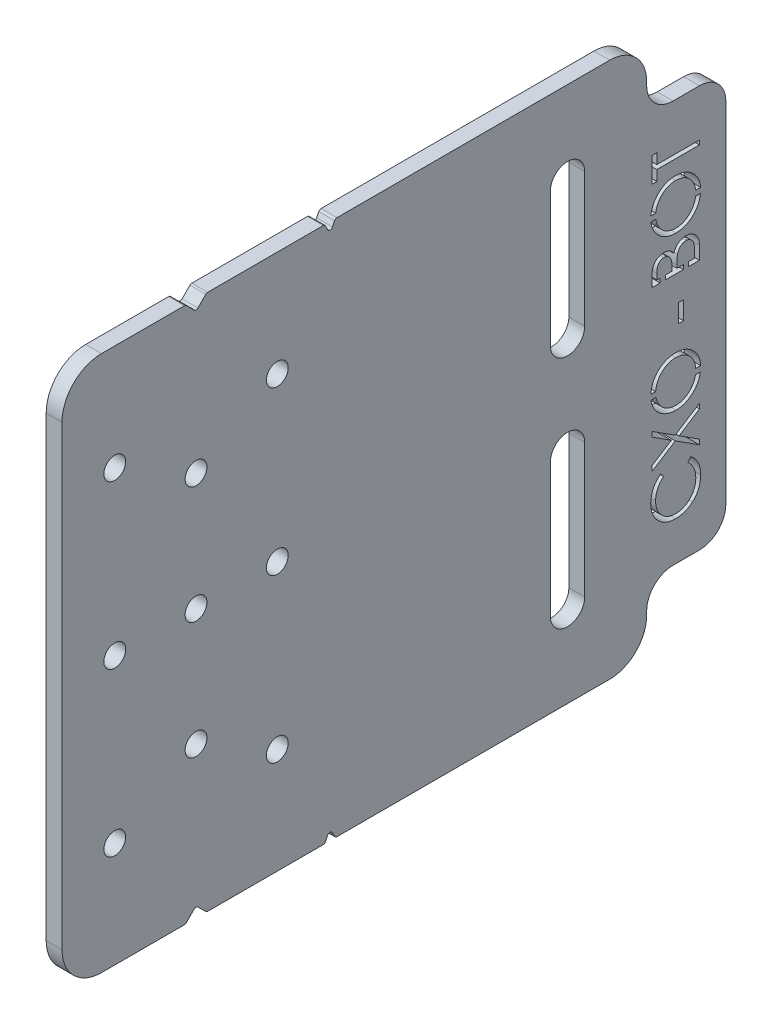
from build123d import *

# Parameters (mm, degrees)
SKETCH1_R           = 2.07
BOSS_EXTRUDE1_DEPTH = 1.5
FILLET1_R           = 7.5
FILLET2_R           = 0.5
FILLET3_R           = 7
SKETCH2_W           = 15
SKETCH2_H           = 76.2
BOSS_EXTRUDE2_DEPTH = 3
FILLET5_R           = 5
SKETCH3_W           = 0.923076923
SKETCH3_H           = 3.461538462
CUT_EXTRUDE2_DEPTH  = 10
SKETCH5_W           = 14.375522983
SKETCH5_H           = 1
SKETCH5_W_2         = 13.468681042
EXTRUDE_THIN2_DEPTH = 3


with BuildPart() as part:
    # Sketch1 → Boss-Extrude1 (new, symmetric)
    with BuildSketch(Plane(origin=(0, 0, 0), x_dir=(0, 0, -1), z_dir=(1, 0, 0))):
        Polygon((-2, 50.8), (-25.4, 50.8), (-25.4, -50.8), (-2, -50.8), (0, -48.8), (2, -50.8), (24.4, -50.8), (25.4, -48.8), (26.4, -50.8), (85.4, -50.8), (85.4, 50.8), (26.4, 50.8), (25.4, 48.8), (24.4, 50.8), (2, 50.8), (0, 48.8), align=None)
        with Locations((-15.4, -30.8)):
            Circle(SKETCH1_R, mode=Mode.SUBTRACT)
        with Locations((15.4, -30.8)):
            Circle(SKETCH1_R, mode=Mode.SUBTRACT)
        with Locations((0, -22.225)):
            Circle(SKETCH1_R, mode=Mode.SUBTRACT)
        with Locations((-15.4, 0)):
            Circle(SKETCH1_R, mode=Mode.SUBTRACT)
        Circle(SKETCH1_R, mode=Mode.SUBTRACT)
        with Locations((0, 22.225)):
            Circle(SKETCH1_R, mode=Mode.SUBTRACT)
        with Locations((15.4, 0)):
            Circle(SKETCH1_R, mode=Mode.SUBTRACT)
        with Locations((-15.4, 30.8)):
            Circle(SKETCH1_R, mode=Mode.SUBTRACT)
        with Locations((15.4, 30.8)):
            Circle(SKETCH1_R, mode=Mode.SUBTRACT)
        with BuildLine():
            Line((73.65, 34.925), (73.65, 9.525))
            ThreePointArc((73.65, 9.525), (70.4, 6.275), (67.15, 9.525))
            Line((67.15, 9.525), (67.15, 34.925))
            ThreePointArc((67.15, 34.925), (70.4, 38.175), (73.65, 34.925))
        make_face(mode=Mode.SUBTRACT)
        with BuildLine():
            ThreePointArc((67.15, -9.525), (70.4, -6.275), (73.65, -9.525))
            Line((73.65, -9.525), (73.65, -34.925))
            ThreePointArc((73.65, -34.925), (70.4, -38.175), (67.15, -34.925))
            Line((67.15, -34.925), (67.15, -9.525))
        make_face(mode=Mode.SUBTRACT)
    extrude(amount=BOSS_EXTRUDE1_DEPTH, both=True)

    # Fillet1
    fillet1_edges = [part.edges().sort_by_distance(p)[0] for p in [
        (0, -50.8, 25.4),
        (0, 50.8, 25.4),
    ]]
    fillet(fillet1_edges, radius=FILLET1_R)

    # Fillet2
    fillet2_edges = [part.edges().sort_by_distance(p)[0] for p in [
        (0, 50.8, -26.4),
        (0, -50.8, -26.4),
        (0, -48.8, -25.4),
        (0, -50.8, -24.4),
        (0, -50.8, -2),
        (0, -48.8, 0),
        (0, -50.8, 2),
        (0, 50.8, 2),
        (0, 48.8, 0),
        (0, 50.8, -2),
        (0, 50.8, -24.4),
        (0, 48.8, -25.4),
    ]]
    fillet(fillet2_edges, radius=FILLET2_R)

    # Fillet3
    fillet3_edges = [part.edges().sort_by_distance(p)[0] for p in [
        (0, 50.8, -85.4),
        (0, -50.8, -85.4),
    ]]
    fillet(fillet3_edges, radius=FILLET3_R)

    # Sketch2 → Boss-Extrude2 (add)
    with BuildSketch(Plane(origin=(1.5, 0, 0), x_dir=(0, 0, -1), z_dir=(1, 0, 0))):
        with Locations((92.9, 0)):
            Rectangle(SKETCH2_W, SKETCH2_H)
    extrude(amount=-BOSS_EXTRUDE2_DEPTH)

    # Fillet5
    fillet5_edges = [part.edges().sort_by_distance(p)[0] for p in [
        (0, -38.1, -100.4),
        (0, -38.1, -85.4),
        (0, 38.1, -85.4),
        (0, 38.1, -100.4),
    ]]
    fillet(fillet5_edges, radius=FILLET5_R)

    # Sketch3 → Cut-Extrude2 (cut)
    # profile 1 of 7: a face of its own
    with BuildSketch(Plane(origin=(1.5, 0, 0), x_dir=(0, 0, -1), z_dir=(1, 0, 0))):
        with BuildLine():
            Line((88.051442308, -21.923076923), (88.592307692, -22.629807692))
            add(Edge.make_bspline(
                [(88.592307692, -22.629807692), (88.532224565, -22.680223351), (88.412868361, -22.780374955), (88.245252139, -22.941491023), (88.088270868, -23.109437947), (87.940915921, -23.28398205), (87.809109799, -23.469162687), (87.682587331, -23.657923953), (87.571812557, -23.857124383), (87.436487312, -24.131181746), (87.298354433, -24.491093437), (87.179548233, -24.942597316), (87.104631774, -25.414572278), (87.096462775, -25.736496657), (87.092307692, -25.900240385)],
                knots=[0, 0, 0, 0, 0.75789156, 1.505565099, 2.245254514, 2.979266606, 3.711207489, 4.440978832, 5.174393176, 5.91211879, 7.394186119, 8.890401545, 10.418332761, 12, 12, 12, 12], degree=3))
            add(Edge.make_bspline(
                [(87.092307692, -25.900240385), (87.093346453, -25.990454583), (87.095414334, -26.170045707), (87.122694942, -26.436570353), (87.161038053, -26.698118199), (87.217931742, -26.954519111), (87.289861332, -27.205446722), (87.375812404, -27.452541459), (87.48215339, -27.6922259), (87.599689033, -27.927815498), (87.732444886, -28.153534052), (87.877252216, -28.367102064), (88.032481322, -28.567753104), (88.198748006, -28.755600138), (88.375178485, -28.931003687), (88.563749363, -29.091756555), (88.76244476, -29.240006523), (88.971429681, -29.374908685), (89.188757754, -29.496351958), (89.415669791, -29.598466868), (89.648280601, -29.687653338), (89.888239229, -29.759336119), (90.133950785, -29.815633522), (90.386433184, -29.854554955), (90.645207733, -29.8815194), (90.820602805, -29.883577803), (90.909014423, -29.884615385)],
                knots=[0, 0, 0, 0, 1.054877232, 2.099964208, 3.13098259, 4.145888998, 5.169474743, 6.183358035, 7.203388855, 8.234598956, 9.261847606, 10.264062591, 11.251197969, 12.227332808, 13.196685059, 14.158975844, 15.123498106, 16.094582253, 17.066912473, 18.032714859, 19.002806091, 19.979168736, 20.95977404, 21.949109834, 22.966205168, 24, 24, 24, 24], degree=3))
            add(Edge.make_bspline(
                [(90.909014423, -29.884615385), (91.042034852, -29.881363099), (91.303202819, -29.874977667), (91.685797913, -29.818389954), (92.05267612, -29.731708664), (92.401353341, -29.603923987), (92.734736223, -29.443214481), (93.048781817, -29.24269333), (93.348090982, -29.00957573), (93.625414624, -28.741470192), (93.87873205, -28.447276029), (94.101805923, -28.131640604), (94.287758227, -27.795337604), (94.442496443, -27.442083559), (94.561442295, -27.069159226), (94.645178618, -26.677235459), (94.699801367, -26.267164611), (94.70503085, -25.986957583), (94.707692308, -25.844350962)],
                knots=[0, 0, 0, 0, 1.029159485, 2.020618137, 2.987588728, 3.942669054, 4.889339625, 5.846988364, 6.821327795, 7.821533711, 8.827683044, 9.822769455, 10.807800696, 11.797391277, 12.803701919, 13.832062008, 14.896664671, 16, 16, 16, 16], degree=3))
            add(Edge.make_bspline(
                [(94.707692308, -25.844350962), (94.703349731, -25.687229761), (94.694802502, -25.377977653), (94.622393004, -24.924459871), (94.50498693, -24.490310759), (94.340677987, -24.075506965), (94.127081532, -23.681217875), (93.868144133, -23.306826463), (93.561402706, -22.95201671), (93.327188947, -22.738661984), (93.207692308, -22.629807692)],
                knots=[0, 0, 0, 0, 1.028121516, 2.023589091, 2.998037872, 3.967518031, 4.937445131, 5.927275754, 6.942489185, 8, 8, 8, 8], degree=3))
            Line((93.207692308, -22.629807692), (93.743149038, -21.923076923))
            add(Edge.make_bspline(
                [(93.743149038, -21.923076923), (93.81653109, -21.979954057), (93.962943696, -22.093435886), (94.16939433, -22.277155496), (94.363406854, -22.470836181), (94.544012376, -22.674975781), (94.71195845, -22.889934105), (94.867336307, -23.115691427), (95.009321356, -23.352055041), (95.139741595, -23.59714754), (95.254572193, -23.851533689), (95.356328878, -24.112974017), (95.440572173, -24.383071525), (95.511832548, -24.659552588), (95.562644402, -24.944914223), (95.603106981, -25.235839313), (95.627112381, -25.535050816), (95.629539346, -25.73673642), (95.630769231, -25.838942308)],
                knots=[0, 0, 0, 0, 0.986911346, 1.969095443, 2.935967484, 3.900112155, 4.865124501, 5.834589912, 6.812044781, 7.795288262, 8.784678562, 9.777857908, 10.776141921, 11.791195789, 12.811324908, 13.855933174, 14.913475973, 16, 16, 16, 16], degree=3))
            add(Edge.make_bspline(
                [(95.630769231, -25.838942308), (95.630095536, -25.935740309), (95.628763387, -26.127146369), (95.607183528, -26.409743159), (95.577741347, -26.684859224), (95.533409582, -26.951708262), (95.481095564, -27.211746483), (95.410969476, -27.462616558), (95.332414476, -27.706787099), (95.240087367, -27.943277117), (95.135902898, -28.172287774), (95.018153175, -28.393080432), (94.88782838, -28.605553544), (94.747801211, -28.811796055), (94.593573863, -29.00876127), (94.427288231, -29.198156049), (94.249504775, -29.381042417), (94.121306581, -29.494192178), (94.056850962, -29.551081731)],
                knots=[0, 0, 0, 0, 1.114604814, 2.203992996, 3.262667896, 4.300477797, 5.318619304, 6.316056647, 7.298880507, 8.271930387, 9.238335007, 10.195173496, 11.151986948, 12.108099108, 13.064862484, 14.031167946, 15.010108607, 16, 16, 16, 16], degree=3))
            add(Edge.make_bspline(
                [(94.056850962, -29.551081731), (93.944885595, -29.642196014), (93.722306605, -29.823324568), (93.361605232, -30.055163831), (92.985337787, -30.252955322), (92.591324864, -30.414662224), (92.17941329, -30.53887199), (91.750265712, -30.62619953), (91.304740018, -30.682551858), (91.001735403, -30.689019932), (90.847716346, -30.692307692)],
                knots=[0, 0, 0, 0, 0.994611881, 1.977215934, 2.950189954, 3.921972279, 4.908960509, 5.911694611, 6.938501887, 8, 8, 8, 8], degree=3))
            add(Edge.make_bspline(
                [(90.847716346, -30.692307692), (90.685830894, -30.688308623), (90.367331374, -30.680440704), (89.899912637, -30.613594373), (89.452094754, -30.506060326), (89.024713697, -30.353325469), (88.615521547, -30.159683137), (88.227644164, -29.920471845), (87.858600964, -29.638470622), (87.513991604, -29.315891162), (87.198890411, -28.962146586), (86.921674459, -28.583326778), (86.690972275, -28.1801732), (86.498125, -27.757127296), (86.349896381, -27.311021258), (86.246131043, -26.84280688), (86.181544173, -26.353363956), (86.173379353, -26.019432005), (86.169230769, -25.849759615)],
                knots=[0, 0, 0, 0, 1.032925535, 2.032216505, 3.007276963, 3.968222605, 4.92396291, 5.891752235, 6.871517503, 7.883894988, 8.900124299, 9.891468569, 10.874487609, 11.85992873, 12.854644235, 13.869047385, 14.917252991, 16, 16, 16, 16], degree=3))
            add(Edge.make_bspline(
                [(86.169230769, -25.849759615), (86.170471631, -25.746351312), (86.172927793, -25.541664991), (86.196842244, -25.238867539), (86.236791833, -24.94409106), (86.290880953, -24.657025535), (86.358995287, -24.376841039), (86.443887565, -24.10406175), (86.544957788, -23.839355637), (86.660375298, -23.582808693), (86.790161627, -23.336152752), (86.932785908, -23.099542661), (87.087527498, -22.87392172), (87.255970599, -22.66046261), (87.436717996, -22.458904168), (87.627652485, -22.266256461), (87.833673592, -22.088127279), (87.978719856, -21.97819442), (88.051442308, -21.923076923)],
                knots=[0, 0, 0, 0, 1.096622143, 2.170653093, 3.219033441, 4.250379162, 5.267604342, 6.275621678, 7.278284436, 8.271072515, 9.257558938, 10.232633088, 11.19973724, 12.157384997, 13.114417402, 14.069920322, 15.032307892, 16, 16, 16, 16], degree=3))
        make_face()
    # profile 2 of 7: a face of its own
    with BuildSketch(Plane(origin=(1.5, 0, 0), x_dir=(0, 0, -1), z_dir=(1, 0, 0))):
        Polygon((86.4, -20.711538462), (86.4, -19.779447115), (90.081490385, -17.423076923), (86.4, -15.066706731), (86.4, -14.134615385), (90.809855769, -16.956129808), (95.4, -14.019230769), (95.4, -14.951322115), (91.538221154, -17.423076923), (95.4, -19.894831731), (95.4, -20.826923077), (90.809855769, -17.888221154), align=None)
    # profile 3 of 7: a face of its own
    with BuildSketch(Plane(origin=(1.5, 0, 0), x_dir=(0, 0, -1), z_dir=(1, 0, 0))):
        with BuildLine():
            add(Edge.make_bspline(
                [(86.169230769, -8.25), (86.173380659, -8.083332415), (86.181531384, -7.755983527), (86.245983692, -7.275328184), (86.352065448, -6.815079142), (86.501875537, -6.374971808), (86.696085494, -5.956680019), (86.931994974, -5.559022408), (87.211037643, -5.183190716), (87.529116027, -4.831771945), (87.877463768, -4.511196611), (88.250376632, -4.229890092), (88.64316612, -3.992581496), (89.055852718, -3.798318563), (89.487472918, -3.645809286), (89.94044573, -3.540596288), (90.411804322, -3.47338188), (90.733302176, -3.465524445), (90.896394231, -3.461538462)],
                knots=[0, 0, 0, 0, 1.065064174, 2.09187391, 3.093564831, 4.079973196, 5.057907931, 6.036227367, 7.030399151, 8.044883615, 9.061699972, 10.052012555, 11.025713132, 11.989727027, 12.962874294, 13.945865945, 14.957962116, 16, 16, 16, 16], degree=3))
            add(Edge.make_bspline(
                [(90.896394231, -3.461538462), (91.058283968, -3.465525787), (91.377387395, -3.473385267), (91.845768283, -3.540650826), (92.295957329, -3.646278752), (92.726951119, -3.796430291), (93.138799535, -3.990842293), (93.531886377, -4.228500242), (93.905795292, -4.509272874), (94.256542866, -4.82848688), (94.577395687, -5.177498228), (94.860400372, -5.548977881), (95.097812271, -5.941756895), (95.294243974, -6.351764919), (95.44357498, -6.782221467), (95.552292883, -7.229994099), (95.618840042, -7.697522429), (95.6267492, -8.016006842), (95.630769231, -8.177884615)],
                knots=[0, 0, 0, 0, 1.043748596, 2.057349401, 3.045489418, 4.02252776, 4.995289225, 5.97782527, 6.980224157, 8.006516136, 9.032559198, 10.034193337, 11.013412982, 11.987833483, 12.961212594, 13.946489799, 14.956251404, 16, 16, 16, 16], degree=3))
            add(Edge.make_bspline(
                [(95.630769231, -8.177884615), (95.626785093, -8.340975721), (95.618931297, -8.662471705), (95.551607685, -9.134424082), (95.446330047, -9.587709709), (95.295877211, -10.021032326), (95.101432903, -10.434633574), (94.864335928, -10.829322358), (94.58300328, -11.203514451), (94.263717802, -11.554107513), (93.916133811, -11.874891166), (93.54370287, -12.154558132), (93.153731695, -12.391708423), (92.745138062, -12.58549985), (92.319897209, -12.738922745), (91.875172553, -12.843592277), (91.413499538, -12.911313297), (91.099160656, -12.919117188), (90.939663462, -12.923076923)],
                knots=[0, 0, 0, 0, 1.053102029, 2.075944431, 3.073151272, 4.055350789, 5.033113405, 6.020478099, 7.024410459, 8.052272461, 9.079885166, 10.07527673, 11.055994387, 12.023226415, 12.992069828, 13.970394897, 14.97016774, 16, 16, 16, 16], degree=3))
            add(Edge.make_bspline(
                [(90.939663462, -12.923076923), (90.832608027, -12.921702146), (90.619847709, -12.918969935), (90.303905023, -12.886077012), (89.993043332, -12.838346923), (89.688146608, -12.769942005), (89.389961219, -12.680477719), (89.096430686, -12.574915362), (88.810529682, -12.445984332), (88.530903818, -12.300234094), (88.26191206, -12.137560873), (88.007650275, -11.957880375), (87.765984854, -11.767503713), (87.543178273, -11.558797843), (87.332748871, -11.33864127), (87.137930456, -11.103462583), (86.956966296, -10.854696812), (86.793885419, -10.59127355), (86.646390501, -10.3196837), (86.519820027, -10.039714843), (86.411187298, -9.755169374), (86.323139462, -9.464714565), (86.253628512, -9.169121722), (86.206295317, -8.867745705), (86.173318499, -8.560826608), (86.170599208, -8.354054645), (86.169230769, -8.25)],
                knots=[0, 0, 0, 0, 1.037015668, 2.060948919, 3.074880161, 4.083647147, 5.086022904, 6.090072063, 7.104153813, 8.122640571, 9.144368836, 10.147691507, 11.138137339, 12.123020368, 13.103399296, 14.087645067, 15.080126199, 16.082011238, 17.087798457, 18.072939717, 19.057185487, 20.037253025, 21.01195951, 21.997135196, 22.992090687, 24, 24, 24, 24], degree=3))
        make_face()
        with BuildLine():
            add(Edge.make_bspline(
                [(87.092307692, -8.210336538), (87.093345208, -8.295746688), (87.095410319, -8.465750461), (87.122761561, -8.718465977), (87.161464843, -8.967934611), (87.217675582, -9.213673607), (87.290381729, -9.456198327), (87.378071082, -9.695616441), (87.484056806, -9.931107063), (87.603250631, -10.162376001), (87.738635748, -10.384081698), (87.882401519, -10.596758085), (88.039889622, -10.794873271), (88.207694135, -10.981148802), (88.387271343, -11.155121431), (88.577441941, -11.316714419), (88.779028469, -11.465795255), (88.991201312, -11.600569814), (89.212775862, -11.720508651), (89.43951657, -11.827894921), (89.67408811, -11.916914041), (89.915026686, -11.987430447), (90.161270534, -12.047282718), (90.41416128, -12.084826492), (90.672827119, -12.112447228), (90.847638597, -12.114397947), (90.936057692, -12.115384615)],
                knots=[0, 0, 0, 0, 1.008406545, 2.007172654, 2.999155034, 3.989332444, 4.982025741, 5.988181096, 6.998684226, 8.030553839, 9.059268815, 10.065399129, 11.060956322, 12.046057109, 13.024974577, 14.012068307, 14.991706172, 15.984221787, 16.978487447, 17.966117052, 18.945677757, 19.938371053, 20.93015022, 21.936155317, 22.956113857, 24, 24, 24, 24], degree=3))
            add(Edge.make_bspline(
                [(90.936057692, -12.115384615), (91.066071875, -12.112098898), (91.321849995, -12.105634877), (91.69672454, -12.049279567), (92.057345603, -11.961782382), (92.401563741, -11.83492799), (92.730913916, -11.673100182), (93.044114418, -11.475703111), (93.341072855, -11.240929033), (93.619578668, -10.974403155), (93.873680759, -10.682964131), (94.097037832, -10.373647106), (94.285021374, -10.048899279), (94.442171391, -9.710592414), (94.560561675, -9.355838106), (94.644973893, -8.986910901), (94.699683851, -8.603802646), (94.704997489, -8.342736574), (94.707692308, -8.210336538)],
                knots=[0, 0, 0, 0, 1.032022337, 2.030307203, 3.003823408, 3.974715386, 4.937372378, 5.913284036, 6.909147208, 7.938749767, 8.970518239, 9.975863271, 10.963918693, 11.946286286, 12.933361397, 13.927862637, 14.949112547, 16, 16, 16, 16], degree=3))
            add(Edge.make_bspline(
                [(94.707692308, -8.210336538), (94.706470569, -8.121340327), (94.704047493, -7.94483411), (94.679607868, -7.682307899), (94.640494456, -7.424486951), (94.58390103, -7.171847632), (94.514008713, -6.924058928), (94.427314498, -6.681868506), (94.323388913, -6.445356809), (94.207567287, -6.213360854), (94.075997041, -5.991075256), (93.934169365, -5.779688916), (93.779460083, -5.581915052), (93.613909255, -5.395726918), (93.434884065, -5.222973543), (93.245869204, -5.061840644), (93.043854831, -4.915337457), (92.832550998, -4.781019787), (92.61259186, -4.659617513), (92.385227794, -4.555337421), (92.151678228, -4.466280065), (91.911771569, -4.394489747), (91.666047466, -4.338205868), (91.414154235, -4.299430825), (91.156601919, -4.272305757), (90.982403394, -4.270261342), (90.894591346, -4.269230769)],
                knots=[0, 0, 0, 0, 1.047334373, 2.07717862, 3.100662057, 4.115010574, 5.122652213, 6.129548646, 7.140165612, 8.16200981, 9.179904151, 10.178566626, 11.156366481, 12.133321541, 13.108841334, 14.082538371, 15.054589433, 16.043660176, 17.028268541, 18.009491307, 18.985652105, 19.968123554, 20.954864208, 21.950389976, 22.966808393, 24, 24, 24, 24], degree=3))
            add(Edge.make_bspline(
                [(90.894591346, -4.269230769), (90.807380049, -4.270262203), (90.634380378, -4.272308241), (90.378623988, -4.299417461), (90.128544301, -4.338248322), (89.885123094, -4.394209572), (89.648298311, -4.466338536), (89.418292403, -4.555277395), (89.194248419, -4.660153843), (88.976720429, -4.780517987), (88.767984634, -4.915815304), (88.568438375, -5.063659554), (88.381812296, -5.226591891), (88.203562198, -5.399999762), (88.037253453, -5.588052269), (87.88352865, -5.790782229), (87.735461462, -6.003141933), (87.60442036, -6.229933736), (87.482798229, -6.463151426), (87.379035884, -6.702679077), (87.289918725, -6.945095882), (87.217458539, -7.19137107), (87.161680158, -7.441388232), (87.122726925, -7.695001972), (87.095419713, -7.951327034), (87.093348325, -8.123726062), (87.092307692, -8.210336538)],
                knots=[0, 0, 0, 0, 1.029877221, 2.042951179, 3.035109885, 4.018542222, 4.991021277, 5.957494829, 6.929429462, 7.911425532, 8.892163142, 9.866273635, 10.842761649, 11.81676864, 12.802607151, 13.805177466, 14.821356543, 15.858816981, 16.897175917, 17.927346774, 18.940346092, 19.946830556, 20.957962087, 21.964146003, 22.97721996, 24, 24, 24, 24], degree=3))
        make_face(mode=Mode.SUBTRACT)
    # profile 4 of 7: a face of its own
    with BuildSketch(Plane(origin=(1.5, 0, 0), x_dir=(0, 0, -1), z_dir=(1, 0, 0))):
        with Locations((91.938461539, 2.769230769)):
            Rectangle(SKETCH3_W, SKETCH3_H)
    # profile 5 of 7: a face of its own
    with BuildSketch(Plane(origin=(1.5, 0, 0), x_dir=(0, 0, -1), z_dir=(1, 0, 0))):
        with BuildLine():
            Line((86.4, 9.461538462), (86.4, 11.217548077))
            add(Edge.make_bspline(
                [(86.4, 11.217548077), (86.400444815, 11.303508376), (86.401306977, 11.470120831), (86.414988862, 11.712380972), (86.433177634, 11.939370306), (86.463688321, 12.150687715), (86.495323878, 12.347708209), (86.541757302, 12.528431617), (86.593044712, 12.694371721), (86.671957352, 12.893631821), (86.794509676, 13.119719708), (86.976266418, 13.362721882), (87.194178075, 13.573954199), (87.442505597, 13.753564281), (87.715694011, 13.897705193), (88.007865581, 14.000665539), (88.31410487, 14.066811187), (88.524060217, 14.073528337), (88.630168269, 14.076923077)],
                knots=[0, 0, 0, 0, 1.00128172, 1.940733171, 2.826250472, 3.653024905, 4.427672124, 5.149348099, 5.824709082, 6.450061444, 7.643590664, 8.808605388, 9.972104426, 11.165284501, 12.367876273, 13.557044126, 14.765369432, 16, 16, 16, 16], degree=3))
            add(Edge.make_bspline(
                [(88.630168269, 14.076923077), (88.729556185, 14.074095506), (88.924862813, 14.068539064), (89.210028688, 14.016053712), (89.481204766, 13.932751956), (89.73815896, 13.81762557), (89.976108045, 13.669291663), (90.194314919, 13.491566792), (90.384532564, 13.27803178), (90.49083494, 13.117965216), (90.544831731, 13.036658654)],
                knots=[0, 0, 0, 0, 1.044641374, 2.052818814, 3.038628718, 4.023282556, 5.005660861, 5.98021751, 6.974042014, 8, 8, 8, 8], degree=3))
            add(Edge.make_bspline(
                [(90.544831731, 13.036658654), (90.584097296, 13.138889881), (90.659222048, 13.334483543), (90.791834056, 13.603804228), (90.936592739, 13.834994909), (91.092234178, 14.032571777), (91.262473367, 14.200658548), (91.44869342, 14.346231412), (91.650741886, 14.472081989), (91.867876175, 14.57917996), (92.098255538, 14.663306751), (92.339066121, 14.725138777), (92.589384776, 14.761713764), (92.759256027, 14.766703153), (92.8453125, 14.769230769)],
                knots=[0, 0, 0, 0, 1.272586185, 2.434772614, 3.483318042, 4.437947805, 5.351807173, 6.25737843, 7.180033415, 8.1141739, 9.066731021, 10.025721652, 10.999834114, 12, 12, 12, 12], degree=3))
            add(Edge.make_bspline(
                [(92.8453125, 14.769230769), (92.933170529, 14.766719429), (93.106033662, 14.761778295), (93.359970329, 14.725307669), (93.602667531, 14.663598786), (93.835583236, 14.578452656), (94.0582291, 14.468089099), (94.269798552, 14.331839109), (94.47073176, 14.171615364), (94.661383346, 13.990536634), (94.83583554, 13.788738555), (94.985805596, 13.566344084), (95.11475847, 13.329445747), (95.219747302, 13.075015021), (95.300746116, 12.803701419), (95.357180011, 12.515655911), (95.395268888, 12.211352868), (95.398396203, 12.002526265), (95.4, 11.895432692)],
                knots=[0, 0, 0, 0, 0.978680899, 1.925582087, 2.851223405, 3.764209995, 4.683484765, 5.614004905, 6.562443559, 7.542772147, 8.539900013, 9.527881485, 10.525548727, 11.540192123, 12.58875426, 13.674701727, 14.807505862, 16, 16, 16, 16], degree=3))
            Line((95.4, 11.895432692), (95.4, 9.461538462))
            Line((95.4, 9.461538462), (86.4, 9.461538462))
        make_face()
        with BuildLine():
            Line((87.323076923, 10.269230769), (90.207692308, 10.269230769))
            Line((90.207692308, 10.269230769), (90.207692308, 10.811899038))
            add(Edge.make_bspline(
                [(90.207692308, 10.811899038), (90.206663934, 10.891224512), (90.204676908, 11.044497494), (90.198985005, 11.26646294), (90.183047185, 11.472498709), (90.167113918, 11.66224911), (90.141207908, 11.83541548), (90.11037078, 11.991613701), (90.077758375, 12.133296714), (90.022290692, 12.296680291), (89.940341833, 12.482036683), (89.813040421, 12.679504994), (89.661535669, 12.854397663), (89.485084964, 13.000313641), (89.29289912, 13.120789066), (89.086665348, 13.20518589), (88.870533836, 13.26145074), (88.721872769, 13.266610861), (88.646394231, 13.269230769)],
                knots=[0, 0, 0, 0, 1.156917035, 2.235399477, 3.236897345, 4.169954739, 5.01148057, 5.788325709, 6.491867502, 7.129259015, 8.302032419, 9.437271567, 10.542795419, 11.662606952, 12.764338259, 13.836858145, 14.901724648, 16, 16, 16, 16], degree=3))
            add(Edge.make_bspline(
                [(88.646394231, 13.269230769), (88.596435699, 13.267900541), (88.498436583, 13.265291153), (88.355112372, 13.243143892), (88.220440184, 13.207259452), (88.093127505, 13.158662247), (87.976338359, 13.092271253), (87.864492259, 13.015315368), (87.76428824, 12.920302403), (87.670902091, 12.812929316), (87.587321799, 12.690075353), (87.518088482, 12.549093624), (87.455340093, 12.393628722), (87.408889326, 12.219462798), (87.36804316, 12.03020463), (87.34237924, 11.823291592), (87.325864263, 11.600034849), (87.32402676, 11.445345967), (87.323076923, 11.365384615)],
                knots=[0, 0, 0, 0, 0.911708768, 1.788416306, 2.640049961, 3.452993646, 4.268229297, 5.087074648, 5.92553149, 6.781184137, 7.681934069, 8.628939405, 9.643570426, 10.73771997, 11.914765019, 13.176320755, 14.540391495, 16, 16, 16, 16], degree=3))
            Line((87.323076923, 11.365384615), (87.323076923, 10.269230769))
        make_face(mode=Mode.SUBTRACT)
        with BuildLine():
            Line((91.130769231, 10.269230769), (94.476923077, 10.269230769))
            Line((94.476923077, 10.269230769), (94.476923077, 11.419471154))
            add(Edge.make_bspline(
                [(94.476923077, 11.419471154), (94.475838179, 11.501796924), (94.473747181, 11.660468992), (94.468843356, 11.88974461), (94.450292931, 12.101693133), (94.433180247, 12.296983181), (94.403918294, 12.475096454), (94.376302617, 12.63740301), (94.335309118, 12.781238474), (94.278968377, 12.949559244), (94.188773845, 13.13770296), (94.057000486, 13.343310176), (93.894371817, 13.522596481), (93.709412505, 13.676497038), (93.508860169, 13.803502461), (93.295336648, 13.894640866), (93.072994567, 13.951277521), (92.921359305, 13.958111262), (92.8453125, 13.961538462)],
                knots=[0, 0, 0, 0, 1.160376723, 2.23647316, 3.230273494, 4.158083346, 4.997711197, 5.773399541, 6.476071462, 7.102777513, 8.27340052, 9.405620712, 10.53304798, 11.669441455, 12.787990954, 13.865552736, 14.929550474, 16, 16, 16, 16], degree=3))
            add(Edge.make_bspline(
                [(92.8453125, 13.961538462), (92.797757172, 13.960830653), (92.703413587, 13.959426454), (92.564787841, 13.938153174), (92.430437571, 13.907377479), (92.299802918, 13.866845004), (92.175080332, 13.810182789), (92.055791501, 13.740719662), (91.939533389, 13.661206772), (91.790654806, 13.538533422), (91.621251631, 13.357498852), (91.457444165, 13.100228526), (91.323205534, 12.809318208), (91.266455186, 12.597830708), (91.237139423, 12.488581731)],
                knots=[0, 0, 0, 0, 0.723302347, 1.434937762, 2.129609326, 2.821140842, 3.513216847, 4.209993937, 4.920569932, 5.655069131, 7.14393391, 8.6716197, 10.280644748, 12, 12, 12, 12], degree=3))
            add(Edge.make_bspline(
                [(91.237139423, 12.488581731), (91.228254921, 12.444792627), (91.208991489, 12.349848818), (91.188657395, 12.195029326), (91.170541527, 12.018279949), (91.157141407, 11.81919255), (91.143290295, 11.597515244), (91.137903612, 11.352774596), (91.131476943, 11.085970073), (91.13101117, 10.900846829), (91.130769231, 10.8046875)],
                knots=[0, 0, 0, 0, 0.634451884, 1.375622551, 2.216452059, 3.157844607, 4.20941857, 5.370758133, 6.634282058, 8, 8, 8, 8], degree=3))
            Line((91.130769231, 10.8046875), (91.130769231, 10.269230769))
        make_face(mode=Mode.SUBTRACT)
    # profile 6 of 7: a face of its own
    with BuildSketch(Plane(origin=(1.5, 0, 0), x_dir=(0, 0, -1), z_dir=(1, 0, 0))):
        with BuildLine():
            add(Edge.make_bspline(
                [(86.169230769, 20.826923077), (86.173380659, 20.993590662), (86.181531384, 21.32093955), (86.245983692, 21.801594893), (86.352065448, 22.261843935), (86.501875537, 22.701951269), (86.696085494, 23.120243058), (86.931994974, 23.517900669), (87.211037643, 23.893732361), (87.529116027, 24.245151132), (87.877463768, 24.565726466), (88.250376632, 24.847032985), (88.64316612, 25.084341581), (89.055852718, 25.278604513), (89.487472918, 25.431113791), (89.94044573, 25.536326789), (90.411804322, 25.603541197), (90.733302176, 25.611398632), (90.896394231, 25.615384615)],
                knots=[0, 0, 0, 0, 1.065064174, 2.09187391, 3.093564831, 4.079973196, 5.057907931, 6.036227367, 7.030399151, 8.044883615, 9.061699972, 10.052012555, 11.025713132, 11.989727027, 12.962874294, 13.945865945, 14.957962116, 16, 16, 16, 16], degree=3))
            add(Edge.make_bspline(
                [(90.896394231, 25.615384615), (91.058283968, 25.61139729), (91.377387395, 25.60353781), (91.845768283, 25.536272251), (92.295957329, 25.430644325), (92.726951119, 25.280492786), (93.138799535, 25.086080784), (93.531886377, 24.848422835), (93.905795292, 24.567650203), (94.256542866, 24.248436197), (94.577395687, 23.899424848), (94.860400372, 23.527945196), (95.097812271, 23.135166182), (95.294243974, 22.725158158), (95.44357498, 22.29470161), (95.552292883, 21.846928978), (95.618840042, 21.379400648), (95.6267492, 21.060916235), (95.630769231, 20.899038462)],
                knots=[0, 0, 0, 0, 1.043748596, 2.057349401, 3.045489418, 4.02252776, 4.995289225, 5.97782527, 6.980224157, 8.006516136, 9.032559198, 10.034193337, 11.013412982, 11.987833483, 12.961212594, 13.946489799, 14.956251404, 16, 16, 16, 16], degree=3))
            add(Edge.make_bspline(
                [(95.630769231, 20.899038462), (95.626785093, 20.735947356), (95.618931297, 20.414451372), (95.551607685, 19.942498995), (95.446330047, 19.489213368), (95.295877211, 19.055890751), (95.101432903, 18.642289503), (94.864335928, 18.247600719), (94.58300328, 17.873408626), (94.263717802, 17.522815564), (93.916133811, 17.202031911), (93.54370287, 16.922364945), (93.153731695, 16.685214654), (92.745138062, 16.491423227), (92.319897209, 16.338000332), (91.875172553, 16.2333308), (91.413499538, 16.16560978), (91.099160656, 16.157805889), (90.939663462, 16.153846154)],
                knots=[0, 0, 0, 0, 1.053102029, 2.075944431, 3.073151272, 4.055350789, 5.033113405, 6.020478099, 7.024410459, 8.052272461, 9.079885166, 10.07527673, 11.055994387, 12.023226415, 12.992069828, 13.970394897, 14.97016774, 16, 16, 16, 16], degree=3))
            add(Edge.make_bspline(
                [(90.939663462, 16.153846154), (90.832608027, 16.155220931), (90.619847709, 16.157953141), (90.303905023, 16.190846065), (89.993043332, 16.238576154), (89.688146608, 16.306981072), (89.389961219, 16.396445358), (89.096430686, 16.502007714), (88.810529682, 16.630938745), (88.530903818, 16.776688983), (88.26191206, 16.939362204), (88.007650275, 17.119042702), (87.765984854, 17.309419364), (87.543178273, 17.518125233), (87.332748871, 17.738281807), (87.137930456, 17.973460493), (86.956966296, 18.222226265), (86.793885419, 18.485649527), (86.646390501, 18.757239377), (86.519820027, 19.037208234), (86.411187298, 19.321753703), (86.323139462, 19.612208512), (86.253628512, 19.907801355), (86.206295317, 20.209177372), (86.173318499, 20.516096468), (86.170599208, 20.722868431), (86.169230769, 20.826923077)],
                knots=[0, 0, 0, 0, 1.037015668, 2.060948919, 3.074880161, 4.083647147, 5.086022904, 6.090072063, 7.104153813, 8.122640571, 9.144368836, 10.147691507, 11.138137339, 12.123020368, 13.103399296, 14.087645067, 15.080126199, 16.082011238, 17.087798457, 18.072939717, 19.057185487, 20.037253025, 21.01195951, 21.997135196, 22.992090687, 24, 24, 24, 24], degree=3))
        make_face()
        with BuildLine():
            add(Edge.make_bspline(
                [(87.092307692, 20.866586538), (87.093345208, 20.781176389), (87.095410319, 20.611172616), (87.122761561, 20.3584571), (87.161464843, 20.108988466), (87.217675582, 19.86324947), (87.290381729, 19.62072475), (87.378071082, 19.381306636), (87.484056806, 19.145816013), (87.603250631, 18.914547076), (87.738635748, 18.692841379), (87.882401519, 18.480164992), (88.039889622, 18.282049806), (88.207694135, 18.095774275), (88.387271343, 17.921801646), (88.577441941, 17.760208658), (88.779028469, 17.611127822), (88.991201312, 17.476353263), (89.212775862, 17.356414426), (89.43951657, 17.249028156), (89.67408811, 17.160009036), (89.915026686, 17.08949263), (90.161270534, 17.029640359), (90.41416128, 16.992096585), (90.672827119, 16.964475849), (90.847638597, 16.96252513), (90.936057692, 16.961538462)],
                knots=[0, 0, 0, 0, 1.008406545, 2.007172654, 2.999155034, 3.989332444, 4.982025741, 5.988181096, 6.998684226, 8.030553839, 9.059268815, 10.065399129, 11.060956322, 12.046057109, 13.024974577, 14.012068307, 14.991706172, 15.984221787, 16.978487447, 17.966117052, 18.945677757, 19.938371053, 20.93015022, 21.936155317, 22.956113857, 24, 24, 24, 24], degree=3))
            add(Edge.make_bspline(
                [(90.936057692, 16.961538462), (91.066071875, 16.964824178), (91.321849995, 16.9712882), (91.69672454, 17.02764351), (92.057345603, 17.115140695), (92.401563741, 17.241995087), (92.730913916, 17.403822894), (93.044114418, 17.601219966), (93.341072855, 17.835994043), (93.619578668, 18.102519922), (93.873680759, 18.393958946), (94.097037832, 18.703275971), (94.285021374, 19.028023798), (94.442171391, 19.366330663), (94.560561675, 19.721084971), (94.644973893, 20.090012176), (94.699683851, 20.473120431), (94.704997489, 20.734186503), (94.707692308, 20.866586538)],
                knots=[0, 0, 0, 0, 1.032022337, 2.030307203, 3.003823408, 3.974715386, 4.937372378, 5.913284036, 6.909147208, 7.938749767, 8.970518239, 9.975863271, 10.963918693, 11.946286286, 12.933361397, 13.927862637, 14.949112547, 16, 16, 16, 16], degree=3))
            add(Edge.make_bspline(
                [(94.707692308, 20.866586538), (94.706470569, 20.95558275), (94.704047493, 21.132088967), (94.679607868, 21.394615178), (94.640494456, 21.652436126), (94.58390103, 21.905075445), (94.514008713, 22.152864149), (94.427314498, 22.395054571), (94.323388913, 22.631566268), (94.207567287, 22.863562223), (94.075997041, 23.085847821), (93.934169365, 23.297234161), (93.779460083, 23.495008025), (93.613909255, 23.681196159), (93.434884065, 23.853949534), (93.245869204, 24.015082433), (93.043854831, 24.16158562), (92.832550998, 24.29590329), (92.61259186, 24.417305564), (92.385227794, 24.521585656), (92.151678228, 24.610643012), (91.911771569, 24.68243333), (91.666047466, 24.738717209), (91.414154235, 24.777492252), (91.156601919, 24.80461732), (90.982403394, 24.806661735), (90.894591346, 24.807692308)],
                knots=[0, 0, 0, 0, 1.047334373, 2.07717862, 3.100662057, 4.115010574, 5.122652213, 6.129548646, 7.140165612, 8.16200981, 9.179904151, 10.178566626, 11.156366481, 12.133321541, 13.108841334, 14.082538371, 15.054589433, 16.043660176, 17.028268541, 18.009491307, 18.985652105, 19.968123554, 20.954864208, 21.950389976, 22.966808393, 24, 24, 24, 24], degree=3))
            add(Edge.make_bspline(
                [(90.894591346, 24.807692308), (90.807380049, 24.806660874), (90.634380378, 24.804614836), (90.378623988, 24.777505616), (90.128544301, 24.738674755), (89.885123094, 24.682713505), (89.648298311, 24.610584541), (89.418292403, 24.521645682), (89.194248419, 24.416769234), (88.976720429, 24.29640509), (88.767984634, 24.161107773), (88.568438375, 24.013263523), (88.381812296, 23.850331186), (88.203562198, 23.676923315), (88.037253453, 23.488870808), (87.88352865, 23.286140847), (87.735461462, 23.073781144), (87.60442036, 22.846989341), (87.482798229, 22.613771651), (87.379035884, 22.374244), (87.289918725, 22.131827194), (87.217458539, 21.885552007), (87.161680158, 21.635534845), (87.122726925, 21.381921105), (87.095419713, 21.125596043), (87.093348325, 20.953197015), (87.092307692, 20.866586538)],
                knots=[0, 0, 0, 0, 1.029877221, 2.042951179, 3.035109885, 4.018542222, 4.991021277, 5.957494829, 6.929429462, 7.911425532, 8.892163142, 9.866273635, 10.842761649, 11.81676864, 12.802607151, 13.805177466, 14.821356543, 15.858816981, 16.897175917, 17.927346774, 18.940346092, 19.946830556, 20.957962087, 21.964146003, 22.97721996, 24, 24, 24, 24], degree=3))
        make_face(mode=Mode.SUBTRACT)
    # profile 7 of 7: a face of its own
    with BuildSketch(Plane(origin=(1.5, 0, 0), x_dir=(0, 0, -1), z_dir=(1, 0, 0))):
        Polygon((87.323076923, 26.423076923), (86.4, 26.423076923), (86.4, 31.153846154), (87.323076923, 31.153846154), (87.323076923, 29.192307692), (95.4, 29.192307692), (95.4, 28.384615385), (87.323076923, 28.384615385), align=None)
    extrude(amount=-CUT_EXTRUDE2_DEPTH, mode=Mode.SUBTRACT)


with BuildPart() as cut_extrude2_piece_1:
    # of the separate pieces the step leaves, piece 1, a body of its own (cut_extrude2_pieces)
    add(part.part.solids().sort_by_distance((-1.5, -43.1, -85.4))[0])



with BuildPart() as cut_extrude2_piece_2:
    # of the separate pieces the step leaves, piece 2, a body of its own (cut_extrude2_pieces)
    add(part.part.solids().sort_by_distance((-1.5, 16.961538462, -90.936057692))[0])


with BuildPart() as cut_extrude2_piece_3:
    # of the separate pieces the step leaves, piece 3, a body of its own (cut_extrude2_pieces)
    add(part.part.solids().sort_by_distance((-1.5, -12.115384615, -90.936057692))[0])


with BuildPart() as cut_extrude2_piece_4:
    # of the separate pieces the step leaves, piece 4, a body of its own (cut_extrude2_pieces)
    add(part.part.solids().sort_by_distance((-1.5, 10.8046875, -91.130769231))[0])


with BuildPart() as cut_extrude2_piece_5:
    # of the separate pieces the step leaves, piece 5, a body of its own (cut_extrude2_pieces)
    add(part.part.solids().sort_by_distance((-1.5, 11.365384615, -87.323076923))[0])


with BuildPart() as cut_extrude2_piece_1_1:
    add(cut_extrude2_piece_1.part)

    add(cut_extrude2_piece_2.part)  # Extrude-Thin2 merges Cut-Extrude2 piece 2

    add(cut_extrude2_piece_3.part)  # Extrude-Thin2 merges Cut-Extrude2 piece 3

    add(cut_extrude2_piece_4.part)  # Extrude-Thin2 merges Cut-Extrude2 piece 4

    add(cut_extrude2_piece_5.part)  # Extrude-Thin2 merges Cut-Extrude2 piece 5
    # Sketch5 → Extrude-Thin2 (add)
    with BuildSketch(Plane(origin=(1.5, 0, 0), x_dir=(0, 0, -1), z_dir=(1, 0, 0))):
        Polygon((87.952686013, 11.35847849), (87.952686013, 6.764786514), (93.331984406, 6.764786514), (93.331984406, 11.834489185), (92.331984406, 11.834489185), (92.331984406, 7.764786514), (88.952686013, 7.764786514), (88.952686013, 11.35847849), align=None)
        with Locations((90.64233521, 20.826923077)):
            Rectangle(SKETCH5_W, SKETCH5_H)
        with Locations((90.737700518, -8.449761707)):
            Rectangle(SKETCH5_W_2, SKETCH5_H)
    extrude(amount=-EXTRUDE_THIN2_DEPTH)


solid = cut_extrude2_piece_1_1.part
